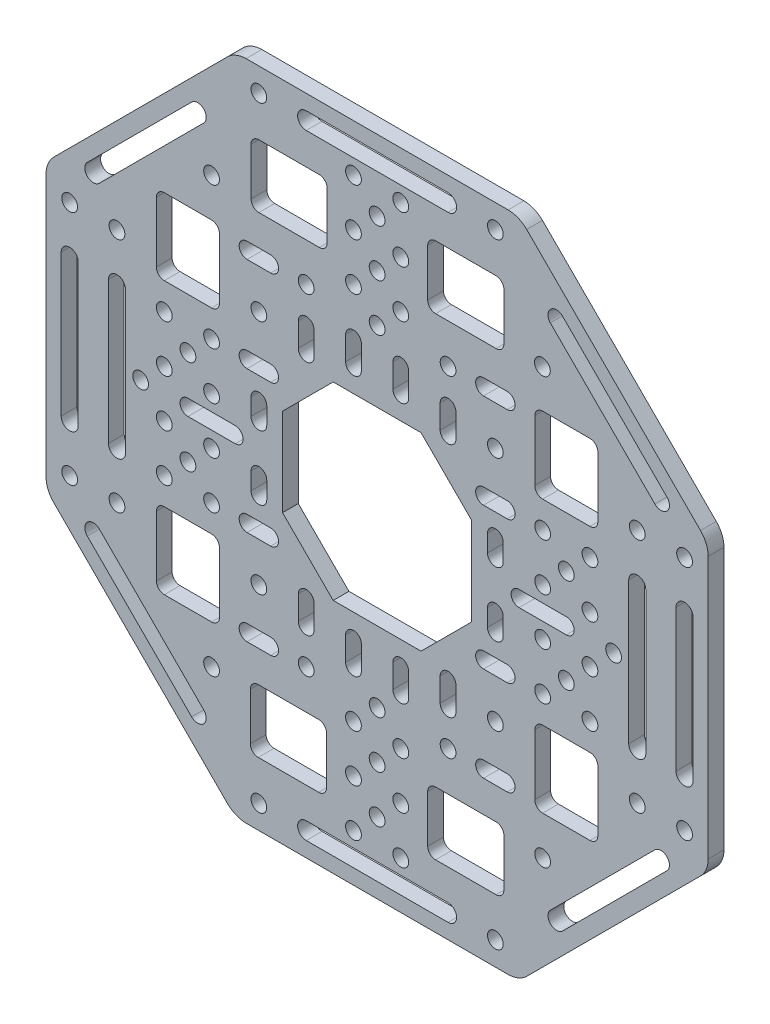
from build123d import *

# Parameters (mm, degrees)
MODEL_R                 = 1.5
SALIENTE_EXTRUIR1_DEPTH = 3


with BuildPart() as part:
    # Model → Saliente-Extruir1 (new body)
    with BuildSketch(Plane.XY):
        with BuildLine():
            Line((181.028054885, 257.495672725), (131.170188866, 257.495672725))
            ThreePointArc((131.170188866, 257.495672725), (129.26119853, 257.10438328), (127.634655856, 256.031205543))
            Line((127.634655856, 256.031205543), (94.565953049, 222.962502736))
            ThreePointArc((94.565953049, 222.962502736), (93.480363501, 221.339566356), (93.099120862, 219.424603899))
            Line((93.099120862, 219.424603899), (93.099120862, 169.566738702))
            ThreePointArc((93.099120862, 169.566738702), (93.480363501, 167.651776245), (94.565953049, 166.028839866))
            Line((94.565953049, 166.028839866), (127.634655856, 132.960137058))
            ThreePointArc((127.634655856, 132.960137058), (129.261198522, 131.886959519), (131.170188866, 131.495670698))
            Line((131.170188866, 131.495670698), (181.028054885, 131.495670698))
            ThreePointArc((181.028054885, 131.495670698), (182.937045229, 131.886959519), (184.563587895, 132.960137058))
            Line((184.563587895, 132.960137058), (217.632290702, 166.028839866))
            ThreePointArc((217.632290702, 166.028839866), (218.71788025, 167.651776245), (219.099122888, 169.566738702))
            Line((219.099122888, 169.566738702), (219.099122888, 219.424603899))
            ThreePointArc((219.099122888, 219.424603899), (218.71788025, 221.339566356), (217.632290702, 222.962502735))
            Line((217.632290702, 222.962502735), (184.563587895, 256.031205543))
            ThreePointArc((184.563587895, 256.031205543), (182.93704522, 257.10438328), (181.028054885, 257.495672725))
        make_face()
        with Locations((120.099121875, 185.495671711)):
            Circle(MODEL_R, mode=Mode.SUBTRACT)
        with Locations((120.099121875, 203.495671711)):
            Circle(MODEL_R, mode=Mode.SUBTRACT)
        with Locations((192.099121875, 203.495671711)):
            Circle(MODEL_R, mode=Mode.SUBTRACT)
        with Locations((192.099121875, 185.495671711)):
            Circle(MODEL_R, mode=Mode.SUBTRACT)
        with Locations((187.599121875, 189.995671711)):
            Circle(MODEL_R, mode=Mode.SUBTRACT)
        with Locations((187.599121875, 198.995671711)):
            Circle(MODEL_R, mode=Mode.SUBTRACT)
        with Locations((124.599121875, 189.995671711)):
            Circle(MODEL_R, mode=Mode.SUBTRACT)
        with Locations((124.599121875, 198.995671711)):
            Circle(MODEL_R, mode=Mode.SUBTRACT)
        with Locations((187.599121875, 153.995671711)):
            Circle(MODEL_R, mode=Mode.SUBTRACT)
        with Locations((160.599121875, 149.495671711)):
            Circle(MODEL_R, mode=Mode.SUBTRACT)
        with Locations((151.599121875, 149.495671711)):
            Circle(MODEL_R, mode=Mode.SUBTRACT)
        with Locations((156.099121875, 153.995671711)):
            Circle(MODEL_R, mode=Mode.SUBTRACT)
        with Locations((156.099121875, 144.995671711)):
            Circle(MODEL_R, mode=Mode.SUBTRACT)
        with Locations((124.599121875, 153.995671711)):
            Circle(MODEL_R, mode=Mode.SUBTRACT)
        with Locations((187.599121875, 180.995671711)):
            Circle(MODEL_R, mode=Mode.SUBTRACT)
        with Locations((196.599121875, 180.995671711)):
            Circle(MODEL_R, mode=Mode.SUBTRACT)
        with Locations((205.599121875, 171.995671711)):
            Circle(MODEL_R, mode=Mode.SUBTRACT)
        with Locations((196.599121875, 198.995671711)):
            Circle(MODEL_R, mode=Mode.SUBTRACT)
        with Locations((201.099121875, 194.495671711)):
            Circle(MODEL_R, mode=Mode.SUBTRACT)
        with Locations((196.599121875, 189.995671711)):
            Circle(MODEL_R, mode=Mode.SUBTRACT)
        with Locations((187.599121875, 207.995671711)):
            Circle(MODEL_R, mode=Mode.SUBTRACT)
        with Locations((196.599121875, 207.995671711)):
            Circle(MODEL_R, mode=Mode.SUBTRACT)
        with Locations((205.599121875, 216.995671711)):
            Circle(MODEL_R, mode=Mode.SUBTRACT)
        with Locations((187.55195757, 234.919478364)):
            Circle(MODEL_R, mode=Mode.SUBTRACT)
        with Locations((169.599121875, 162.995671711)):
            Circle(MODEL_R, mode=Mode.SUBTRACT)
        with Locations((178.599121875, 171.995671711)):
            Circle(MODEL_R, mode=Mode.SUBTRACT)
        with Locations((133.599121875, 171.995671711)):
            Circle(MODEL_R, mode=Mode.SUBTRACT)
        with Locations((142.599121875, 162.995671711)):
            Circle(MODEL_R, mode=Mode.SUBTRACT)
        with Locations((156.099121875, 162.995671711)):
            Circle(MODEL_R, mode=Mode.SUBTRACT)
        with Locations((160.599121875, 230.495671711)):
            Circle(MODEL_R, mode=Mode.SUBTRACT)
        with Locations((178.599121875, 216.995671711)):
            Circle(MODEL_R, mode=Mode.SUBTRACT)
        with Locations((169.599121875, 225.995671711)):
            Circle(MODEL_R, mode=Mode.SUBTRACT)
        with Locations((160.599121875, 239.495671711)):
            Circle(MODEL_R, mode=Mode.SUBTRACT)
        with Locations((133.599121875, 216.995671711)):
            Circle(MODEL_R, mode=Mode.SUBTRACT)
        with Locations((142.599121875, 225.995671711)):
            Circle(MODEL_R, mode=Mode.SUBTRACT)
        with Locations((151.599121875, 230.495671711)):
            Circle(MODEL_R, mode=Mode.SUBTRACT)
        with Locations((151.599121875, 239.495671711)):
            Circle(MODEL_R, mode=Mode.SUBTRACT)
        with Locations((156.099121875, 243.995671711)):
            Circle(MODEL_R, mode=Mode.SUBTRACT)
        with Locations((156.099121875, 225.995671711)):
            Circle(MODEL_R, mode=Mode.SUBTRACT)
        with Locations((156.099121875, 234.995671711)):
            Circle(MODEL_R, mode=Mode.SUBTRACT)
        with Locations((106.599121875, 171.995671711)):
            Circle(MODEL_R, mode=Mode.SUBTRACT)
        with Locations((115.599121875, 180.995671711)):
            Circle(MODEL_R, mode=Mode.SUBTRACT)
        with Locations((124.599121875, 180.995671711)):
            Circle(MODEL_R, mode=Mode.SUBTRACT)
        with Locations((115.599121875, 198.995671711)):
            Circle(MODEL_R, mode=Mode.SUBTRACT)
        with Locations((115.599121875, 189.995671711)):
            Circle(MODEL_R, mode=Mode.SUBTRACT)
        with Locations((111.099121875, 194.495671711)):
            Circle(MODEL_R, mode=Mode.SUBTRACT)
        with Locations((106.599121875, 216.995671711)):
            Circle(MODEL_R, mode=Mode.SUBTRACT)
        with Locations((124.599121875, 234.995671711)):
            Circle(MODEL_R, mode=Mode.SUBTRACT)
        with Locations((115.599121875, 207.995671711)):
            Circle(MODEL_R, mode=Mode.SUBTRACT)
        with Locations((124.599121875, 207.995671711)):
            Circle(MODEL_R, mode=Mode.SUBTRACT)
        with Locations((151.599121875, 158.495671711)):
            Circle(MODEL_R, mode=Mode.SUBTRACT)
        with Locations((160.599121875, 158.495671711)):
            Circle(MODEL_R, mode=Mode.SUBTRACT)
        with Locations((160.599121875, 248.495671711)):
            Circle(MODEL_R, mode=Mode.SUBTRACT)
        with Locations((151.599121875, 248.495671711)):
            Circle(MODEL_R, mode=Mode.SUBTRACT)
        with Locations((160.599121875, 140.495671711)):
            Circle(MODEL_R, mode=Mode.SUBTRACT)
        with Locations((151.599121875, 140.495671711)):
            Circle(MODEL_R, mode=Mode.SUBTRACT)
        with Locations((97.599121875, 216.995671711)):
            Circle(MODEL_R, mode=Mode.SUBTRACT)
        with Locations((97.599121875, 171.995671711)):
            Circle(MODEL_R, mode=Mode.SUBTRACT)
        with Locations((214.599121875, 171.995671711)):
            Circle(MODEL_R, mode=Mode.SUBTRACT)
        with Locations((214.599121875, 216.995671711)):
            Circle(MODEL_R, mode=Mode.SUBTRACT)
        with Locations((133.599121875, 135.995671711)):
            Circle(MODEL_R, mode=Mode.SUBTRACT)
        with Locations((178.599121875, 135.995671711)):
            Circle(MODEL_R, mode=Mode.SUBTRACT)
        with Locations((178.599121875, 252.995671711)):
            Circle(MODEL_R, mode=Mode.SUBTRACT)
        with Locations((133.599121875, 252.995671711)):
            Circle(MODEL_R, mode=Mode.SUBTRACT)
        Polygon((174.0991211, 202.856061331), (164.459511495, 212.495670936), (147.738732255, 212.495670936), (138.09912265, 202.856061331), (138.09912265, 186.135282091), (147.738732255, 176.495672486), (164.459511495, 176.495672486), (174.0991211, 186.135282091), align=None, mode=Mode.SUBTRACT)
        with BuildLine():
            Line((142.599121875, 254.620671711), (169.599121875, 254.620671711))
            ThreePointArc((169.599121875, 254.620671711), (171.224121875, 252.995671711), (169.599121875, 251.370671711))
            Line((169.599121875, 251.370671711), (142.599121875, 251.370671711))
            ThreePointArc((142.599121875, 251.370671711), (140.974121875, 252.995671711), (142.599121875, 254.620671711))
        make_face(mode=Mode.SUBTRACT)
        with BuildLine():
            Line((123.146286181, 242.890467067), (103.248170395, 222.989733229))
            ThreePointArc((103.248170395, 222.989733229), (100.950073356, 222.989733229), (100.950073356, 225.287830268))
            Line((100.950073356, 225.287830268), (120.772473344, 245.110230256))
            ThreePointArc((120.772473344, 245.110230256), (123.069261357, 245.18725508), (123.146286181, 242.890467067))
        make_face(mode=Mode.SUBTRACT)
        with BuildLine():
            Line((95.974121875, 207.995671711), (95.974121875, 180.995671711))
            ThreePointArc((95.974121875, 180.995671711), (97.599121875, 179.370671711), (99.224121875, 180.995671711))
            Line((99.224121875, 180.995671711), (99.224121875, 207.995671711))
            ThreePointArc((99.224121875, 207.995671711), (97.599121875, 209.620671711), (95.974121875, 207.995671711))
        make_face(mode=Mode.SUBTRACT)
        with BuildLine():
            Line((104.974121875, 207.995671711), (104.974121875, 180.995671711))
            ThreePointArc((104.974121875, 180.995671711), (106.599121875, 179.370671711), (108.224121875, 180.995671711))
            Line((108.224121875, 180.995671711), (108.224121875, 207.995671711))
            ThreePointArc((108.224121875, 207.995671711), (106.599121875, 209.620671711), (104.974121875, 207.995671711))
        make_face(mode=Mode.SUBTRACT)
        with BuildLine():
            Line((203.974121875, 207.995671711), (203.974121875, 180.995671711))
            ThreePointArc((203.974121875, 180.995671711), (205.599121875, 179.370671711), (207.224121875, 180.995671711))
            Line((207.224121875, 180.995671711), (207.224121875, 207.995671711))
            ThreePointArc((207.224121875, 207.995671711), (205.599121875, 209.620671711), (203.974121875, 207.995671711))
        make_face(mode=Mode.SUBTRACT)
        with BuildLine():
            Line((212.974121875, 207.995671711), (212.974121875, 180.995671711))
            ThreePointArc((212.974121875, 180.995671711), (214.599121875, 179.370671711), (216.224121875, 180.995671711))
            Line((216.224121875, 180.995671711), (216.224121875, 207.995671711))
            ThreePointArc((216.224121875, 207.995671711), (214.599121875, 209.620671711), (212.974121875, 207.995671711))
        make_face(mode=Mode.SUBTRACT)
        with BuildLine():
            Line((208.950073356, 222.989733229), (189.05195757, 242.890467067))
            ThreePointArc((189.05195757, 242.890467067), (189.128982394, 245.18725508), (191.425770406, 245.110230256))
            Line((191.425770406, 245.110230256), (211.248170395, 225.287830268))
            ThreePointArc((211.248170395, 225.287830268), (211.248170395, 222.989733229), (208.950073356, 222.989733229))
        make_face(mode=Mode.SUBTRACT)
        with BuildLine():
            Line((103.213880902, 166.034846023), (123.104058626, 146.144720231))
            ThreePointArc((123.104058626, 146.144720231), (123.104058626, 143.846623192), (120.805961587, 143.846623192))
            Line((120.805961587, 143.846623192), (100.950077138, 163.703513155))
            ThreePointArc((100.950077138, 163.703513155), (100.934294438, 165.983620478), (103.213880902, 166.034846023))
        make_face(mode=Mode.SUBTRACT)
        with BuildLine():
            Line((142.599121875, 137.620671711), (169.599121875, 137.620671711))
            ThreePointArc((169.599121875, 137.620671711), (171.224121875, 135.995671711), (169.599121875, 134.370671711))
            Line((169.599121875, 134.370671711), (142.599121875, 134.370671711))
            ThreePointArc((142.599121875, 134.370671711), (140.974121875, 135.995671711), (142.599121875, 137.620671711))
        make_face(mode=Mode.SUBTRACT)
        with BuildLine():
            Line((189.094188906, 146.144716449), (208.950073356, 166.001606412))
            ThreePointArc((208.950073356, 166.001606412), (211.248168504, 165.999521788), (211.246083881, 163.70142664))
            Line((211.246083881, 163.70142664), (191.392285945, 143.84661941))
            ThreePointArc((191.392285945, 143.84661941), (189.094188906, 143.84661941), (189.094188906, 146.144716449))
        make_face(mode=Mode.SUBTRACT)
        with BuildLine():
            Line((131.349121875, 227.495671711), (135.849121875, 227.495671711))
            ThreePointArc((135.849121875, 227.495671711), (137.349121875, 225.995671711), (135.849121875, 224.495671711))
            Line((135.849121875, 224.495671711), (131.349121875, 224.495671711))
            ThreePointArc((131.349121875, 224.495671711), (129.849121875, 225.995671711), (131.349121875, 227.495671711))
        make_face(mode=Mode.SUBTRACT)
        with BuildLine():
            Line((141.099121875, 219.245671711), (141.099121875, 214.745671711))
            ThreePointArc((141.099121875, 214.745671711), (142.599121875, 213.245671711), (144.099121875, 214.745671711))
            Line((144.099121875, 214.745671711), (144.099121875, 219.245671711))
            ThreePointArc((144.099121875, 219.245671711), (142.599121875, 220.745671711), (141.099121875, 219.245671711))
        make_face(mode=Mode.SUBTRACT)
        with BuildLine():
            Line((150.099121875, 221.495671711), (150.099121875, 216.995671711))
            ThreePointArc((150.099121875, 216.995671711), (151.599121875, 215.495671711), (153.099121875, 216.995671711))
            Line((153.099121875, 216.995671711), (153.099121875, 221.495671711))
            ThreePointArc((153.099121875, 221.495671711), (151.599121875, 222.995671711), (150.099121875, 221.495671711))
        make_face(mode=Mode.SUBTRACT)
        with BuildLine():
            Line((159.099121875, 221.495671711), (159.099121875, 216.995671711))
            ThreePointArc((159.099121875, 216.995671711), (160.599121875, 215.495671711), (162.099121875, 216.995671711))
            Line((162.099121875, 216.995671711), (162.099121875, 221.495671711))
            ThreePointArc((162.099121875, 221.495671711), (160.599121875, 222.995671711), (159.099121875, 221.495671711))
        make_face(mode=Mode.SUBTRACT)
        with BuildLine():
            Line((168.099121875, 219.245671711), (168.099121875, 214.745671711))
            ThreePointArc((168.099121875, 214.745671711), (169.599121875, 213.245671711), (171.099121875, 214.745671711))
            Line((171.099121875, 214.745671711), (171.099121875, 219.245671711))
            ThreePointArc((171.099121875, 219.245671711), (169.599121875, 220.745671711), (168.099121875, 219.245671711))
        make_face(mode=Mode.SUBTRACT)
        with BuildLine():
            Line((176.349121875, 224.495671711), (180.849121875, 224.495671711))
            ThreePointArc((180.849121875, 224.495671711), (182.349121875, 225.995671711), (180.849121875, 227.495671711))
            Line((180.849121875, 227.495671711), (176.349121875, 227.495671711))
            ThreePointArc((176.349121875, 227.495671711), (174.849121875, 225.995671711), (176.349121875, 224.495671711))
        make_face(mode=Mode.SUBTRACT)
        with BuildLine():
            Line((176.349121875, 209.495671711), (180.849121875, 209.495671711))
            ThreePointArc((180.849121875, 209.495671711), (182.349121875, 207.995671711), (180.849121875, 206.495671711))
            Line((180.849121875, 206.495671711), (176.349121875, 206.495671711))
            ThreePointArc((176.349121875, 206.495671711), (174.849121875, 207.995671711), (176.349121875, 209.495671711))
        make_face(mode=Mode.SUBTRACT)
        with BuildLine():
            Line((177.099121875, 202.245671711), (177.099121875, 198.995671711))
            ThreePointArc((177.099121875, 198.995671711), (178.599121875, 197.495671711), (180.099121875, 198.995671711))
            Line((180.099121875, 198.995671711), (180.099121875, 202.245671711))
            ThreePointArc((180.099121875, 202.245671711), (178.599121875, 203.745671711), (177.099121875, 202.245671711))
        make_face(mode=Mode.SUBTRACT)
        with BuildLine():
            Line((183.099121875, 195.995671711), (192.099121875, 195.995671711))
            ThreePointArc((192.099121875, 195.995671711), (193.599121875, 194.495671711), (192.099121875, 192.995671711))
            Line((192.099121875, 192.995671711), (183.099121875, 192.995671711))
            ThreePointArc((183.099121875, 192.995671711), (181.599121875, 194.495671711), (183.099121875, 195.995671711))
        make_face(mode=Mode.SUBTRACT)
        with BuildLine():
            Line((180.099121875, 189.995671711), (180.099121875, 186.745671711))
            ThreePointArc((180.099121875, 186.745671711), (178.599121875, 185.245671711), (177.099121875, 186.745671711))
            Line((177.099121875, 186.745671711), (177.099121875, 189.995671711))
            ThreePointArc((177.099121875, 189.995671711), (178.599121875, 191.495671711), (180.099121875, 189.995671711))
        make_face(mode=Mode.SUBTRACT)
        with BuildLine():
            Line((176.349121875, 182.495671711), (180.849121875, 182.495671711))
            ThreePointArc((180.849121875, 182.495671711), (182.349121875, 180.995671711), (180.849121875, 179.495671711))
            Line((180.849121875, 179.495671711), (176.349121875, 179.495671711))
            ThreePointArc((176.349121875, 179.495671711), (174.849121875, 180.995671711), (176.349121875, 182.495671711))
        make_face(mode=Mode.SUBTRACT)
        with BuildLine():
            Line((171.099121875, 174.245671711), (171.099121875, 169.745671711))
            ThreePointArc((171.099121875, 169.745671711), (169.599121875, 168.245671711), (168.099121875, 169.745671711))
            Line((168.099121875, 169.745671711), (168.099121875, 174.245671711))
            ThreePointArc((168.099121875, 174.245671711), (169.599121875, 175.745671711), (171.099121875, 174.245671711))
        make_face(mode=Mode.SUBTRACT)
        with BuildLine():
            Line((162.099121875, 171.995671711), (162.099121875, 167.495671711))
            ThreePointArc((162.099121875, 167.495671711), (160.599121875, 165.995671711), (159.099121875, 167.495671711))
            Line((159.099121875, 167.495671711), (159.099121875, 171.995671711))
            ThreePointArc((159.099121875, 171.995671711), (160.599121875, 173.495671711), (162.099121875, 171.995671711))
        make_face(mode=Mode.SUBTRACT)
        with BuildLine():
            Line((153.099121875, 171.995671711), (153.099121875, 167.495671711))
            ThreePointArc((153.099121875, 167.495671711), (151.599121875, 165.995671711), (150.099121875, 167.495671711))
            Line((150.099121875, 167.495671711), (150.099121875, 171.995671711))
            ThreePointArc((150.099121875, 171.995671711), (151.599121875, 173.495671711), (153.099121875, 171.995671711))
        make_face(mode=Mode.SUBTRACT)
        with BuildLine():
            Line((144.099121875, 174.245671711), (144.099121875, 169.745671711))
            ThreePointArc((144.099121875, 169.745671711), (142.599121875, 168.245671711), (141.099121875, 169.745671711))
            Line((141.099121875, 169.745671711), (141.099121875, 174.245671711))
            ThreePointArc((141.099121875, 174.245671711), (142.599121875, 175.745671711), (144.099121875, 174.245671711))
        make_face(mode=Mode.SUBTRACT)
        with BuildLine():
            Line((131.349121875, 164.495671711), (135.849121875, 164.495671711))
            ThreePointArc((135.849121875, 164.495671711), (137.349121875, 162.995671711), (135.849121875, 161.495671711))
            Line((135.849121875, 161.495671711), (131.349121875, 161.495671711))
            ThreePointArc((131.349121875, 161.495671711), (129.849121875, 162.995671711), (131.349121875, 164.495671711))
        make_face(mode=Mode.SUBTRACT)
        with BuildLine():
            Line((131.349121875, 179.495671711), (135.849121875, 179.495671711))
            ThreePointArc((135.849121875, 179.495671711), (137.349121875, 180.995671711), (135.849121875, 182.495671711))
            Line((135.849121875, 182.495671711), (131.349121875, 182.495671711))
            ThreePointArc((131.349121875, 182.495671711), (129.849121875, 180.995671711), (131.349121875, 179.495671711))
        make_face(mode=Mode.SUBTRACT)
        with BuildLine():
            Line((132.099121875, 186.745671711), (132.099121875, 189.995671711))
            ThreePointArc((132.099121875, 189.995671711), (133.599121875, 191.495671711), (135.099121875, 189.995671711))
            Line((135.099121875, 189.995671711), (135.099121875, 186.745671711))
            ThreePointArc((135.099121875, 186.745671711), (133.599121875, 185.245671711), (132.099121875, 186.745671711))
        make_face(mode=Mode.SUBTRACT)
        with BuildLine():
            Line((129.099121875, 192.995671711), (120.099121875, 192.995671711))
            ThreePointArc((120.099121875, 192.995671711), (118.599121875, 194.495671711), (120.099121875, 195.995671711))
            Line((120.099121875, 195.995671711), (129.099121875, 195.995671711))
            ThreePointArc((129.099121875, 195.995671711), (130.599121875, 194.495671711), (129.099121875, 192.995671711))
        make_face(mode=Mode.SUBTRACT)
        with BuildLine():
            Line((132.099121875, 202.245671711), (132.099121875, 198.995671711))
            ThreePointArc((132.099121875, 198.995671711), (133.599121875, 197.495671711), (135.099121875, 198.995671711))
            Line((135.099121875, 198.995671711), (135.099121875, 202.245671711))
            ThreePointArc((135.099121875, 202.245671711), (133.599121875, 203.745671711), (132.099121875, 202.245671711))
        make_face(mode=Mode.SUBTRACT)
        with BuildLine():
            Line((135.849121875, 206.495671711), (131.349121875, 206.495671711))
            ThreePointArc((131.349121875, 206.495671711), (129.849121875, 207.995671711), (131.349121875, 209.495671711))
            Line((131.349121875, 209.495671711), (135.849121875, 209.495671711))
            ThreePointArc((135.849121875, 209.495671711), (137.349121875, 207.995671711), (135.849121875, 206.495671711))
        make_face(mode=Mode.SUBTRACT)
        with BuildLine():
            Line((132.104752837, 243.841546665), (132.104752837, 234.841546665))
            ThreePointArc((132.104752837, 234.841546665), (132.544092665, 233.780886493), (133.604752837, 233.341546665))
            Line((133.604752837, 233.341546665), (145.104752837, 233.341546665))
            ThreePointArc((145.104752837, 233.341546665), (146.165413008, 233.780886493), (146.604752837, 234.841546665))
            Line((146.604752837, 234.841546665), (146.604752837, 243.841546665))
            ThreePointArc((146.604752837, 243.841546665), (146.165413008, 244.902206837), (145.104752837, 245.341546665))
            Line((145.104752837, 245.341546665), (133.604752837, 245.341546665))
            ThreePointArc((133.604752837, 245.341546665), (132.544092665, 244.902206837), (132.104752837, 243.841546665))
        make_face(mode=Mode.SUBTRACT)
        with BuildLine():
            Line((131.974121875, 153.995671711), (131.974121875, 144.995671711))
            ThreePointArc((131.974121875, 144.995671711), (132.413461704, 143.935011539), (133.474121875, 143.495671711))
            Line((133.474121875, 143.495671711), (144.974121875, 143.495671711))
            ThreePointArc((144.974121875, 143.495671711), (146.034782047, 143.935011539), (146.474121875, 144.995671711))
            Line((146.474121875, 144.995671711), (146.474121875, 153.995671711))
            ThreePointArc((146.474121875, 153.995671711), (146.034782047, 155.056331883), (144.974121875, 155.495671711))
            Line((144.974121875, 155.495671711), (133.474121875, 155.495671711))
            ThreePointArc((133.474121875, 155.495671711), (132.413461704, 155.056331883), (131.974121875, 153.995671711))
        make_face(mode=Mode.SUBTRACT)
        with BuildLine():
            Line((165.724121875, 153.995671711), (165.724121875, 144.995671711))
            ThreePointArc((165.724121875, 144.995671711), (166.163461704, 143.935011539), (167.224121875, 143.495671711))
            Line((167.224121875, 143.495671711), (178.724121875, 143.495671711))
            ThreePointArc((178.724121875, 143.495671711), (179.784782047, 143.935011539), (180.224121875, 144.995671711))
            Line((180.224121875, 144.995671711), (180.224121875, 153.995671711))
            ThreePointArc((180.224121875, 153.995671711), (179.784782047, 155.056331883), (178.724121875, 155.495671711))
            Line((178.724121875, 155.495671711), (167.224121875, 155.495671711))
            ThreePointArc((167.224121875, 155.495671711), (166.163461704, 155.056331883), (165.724121875, 153.995671711))
        make_face(mode=Mode.SUBTRACT)
        with BuildLine():
            Line((165.724121875, 243.995671711), (165.724121875, 234.995671711))
            ThreePointArc((165.724121875, 234.995671711), (166.163461704, 233.935011539), (167.224121875, 233.495671711))
            Line((167.224121875, 233.495671711), (178.724121875, 233.495671711))
            ThreePointArc((178.724121875, 233.495671711), (179.784782047, 233.935011539), (180.224121875, 234.995671711))
            Line((180.224121875, 234.995671711), (180.224121875, 243.995671711))
            ThreePointArc((180.224121875, 243.995671711), (179.784782047, 245.056331883), (178.724121875, 245.495671711))
            Line((178.724121875, 245.495671711), (167.224121875, 245.495671711))
            ThreePointArc((167.224121875, 245.495671711), (166.163461704, 245.056331883), (165.724121875, 243.995671711))
        make_face(mode=Mode.SUBTRACT)
        with BuildLine():
            Line((115.599121875, 213.120671711), (124.599121875, 213.120671711))
            ThreePointArc((124.599121875, 213.120671711), (125.659782047, 213.560011539), (126.099121875, 214.620671711))
            Line((126.099121875, 214.620671711), (126.099121875, 226.120671711))
            ThreePointArc((126.099121875, 226.120671711), (125.659782047, 227.181331883), (124.599121875, 227.620671711))
            Line((124.599121875, 227.620671711), (115.599121875, 227.620671711))
            ThreePointArc((115.599121875, 227.620671711), (114.538461704, 227.181331883), (114.099121875, 226.120671711))
            Line((114.099121875, 226.120671711), (114.099121875, 214.620671711))
            ThreePointArc((114.099121875, 214.620671711), (114.538461704, 213.560011539), (115.599121875, 213.120671711))
        make_face(mode=Mode.SUBTRACT)
        with BuildLine():
            Line((115.599121875, 161.370671711), (124.599121875, 161.370671711))
            ThreePointArc((124.599121875, 161.370671711), (125.659782047, 161.810011539), (126.099121875, 162.870671711))
            Line((126.099121875, 162.870671711), (126.099121875, 174.370671711))
            ThreePointArc((126.099121875, 174.370671711), (125.659782047, 175.431331883), (124.599121875, 175.870671711))
            Line((124.599121875, 175.870671711), (115.599121875, 175.870671711))
            ThreePointArc((115.599121875, 175.870671711), (114.538461704, 175.431331883), (114.099121875, 174.370671711))
            Line((114.099121875, 174.370671711), (114.099121875, 162.870671711))
            ThreePointArc((114.099121875, 162.870671711), (114.538461704, 161.810011539), (115.599121875, 161.370671711))
        make_face(mode=Mode.SUBTRACT)
        with BuildLine():
            Line((187.599121875, 213.120671711), (196.599121875, 213.120671711))
            ThreePointArc((196.599121875, 213.120671711), (197.659782047, 213.560011539), (198.099121875, 214.620671711))
            Line((198.099121875, 214.620671711), (198.099121875, 226.120671711))
            ThreePointArc((198.099121875, 226.120671711), (197.659782047, 227.181331883), (196.599121875, 227.620671711))
            Line((196.599121875, 227.620671711), (187.599121875, 227.620671711))
            ThreePointArc((187.599121875, 227.620671711), (186.538461704, 227.181331883), (186.099121875, 226.120671711))
            Line((186.099121875, 226.120671711), (186.099121875, 214.620671711))
            ThreePointArc((186.099121875, 214.620671711), (186.538461704, 213.560011539), (187.599121875, 213.120671711))
        make_face(mode=Mode.SUBTRACT)
        with BuildLine():
            Line((187.599121875, 161.370671711), (196.599121875, 161.370671711))
            ThreePointArc((196.599121875, 161.370671711), (197.659782047, 161.810011539), (198.099121875, 162.870671711))
            Line((198.099121875, 162.870671711), (198.099121875, 174.370671711))
            ThreePointArc((198.099121875, 174.370671711), (197.659782047, 175.431331883), (196.599121875, 175.870671711))
            Line((196.599121875, 175.870671711), (187.599121875, 175.870671711))
            ThreePointArc((187.599121875, 175.870671711), (186.538461704, 175.431331883), (186.099121875, 174.370671711))
            Line((186.099121875, 174.370671711), (186.099121875, 162.870671711))
            ThreePointArc((186.099121875, 162.870671711), (186.538461704, 161.810011539), (187.599121875, 161.370671711))
        make_face(mode=Mode.SUBTRACT)
        with BuildLine():
            Line((176.349121875, 164.495671711), (180.849121875, 164.495671711))
            ThreePointArc((180.849121875, 164.495671711), (182.349121875, 162.995671711), (180.849121875, 161.495671711))
            Line((180.849121875, 161.495671711), (176.349121875, 161.495671711))
            ThreePointArc((176.349121875, 161.495671711), (174.849121875, 162.995671711), (176.349121875, 164.495671711))
        make_face(mode=Mode.SUBTRACT)
    extrude(amount=SALIENTE_EXTRUIR1_DEPTH)


solid = part.part
